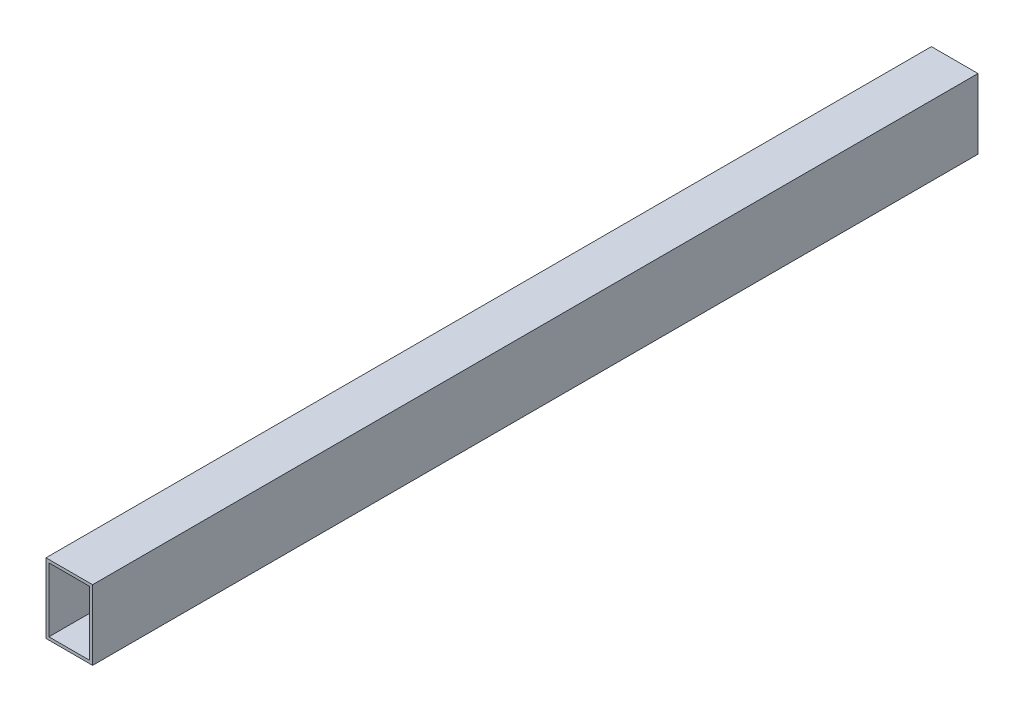
from build123d import *

# Parameters (mm, degrees)
SKETCH1_W           = 50.8
SKETCH1_H           = 76.2
SKETCH1_W_2         = 44.45
SKETCH1_H_2         = 69.85
BOSS_EXTRUDE1_DEPTH = 965.2


with BuildPart() as part:
    # Sketch1 → Boss-Extrude1 (new body)
    with BuildSketch(Plane.XY):
        Rectangle(SKETCH1_W, SKETCH1_H)
        Rectangle(SKETCH1_W_2, SKETCH1_H_2, mode=Mode.SUBTRACT)
    extrude(amount=BOSS_EXTRUDE1_DEPTH)


solid = part.part
